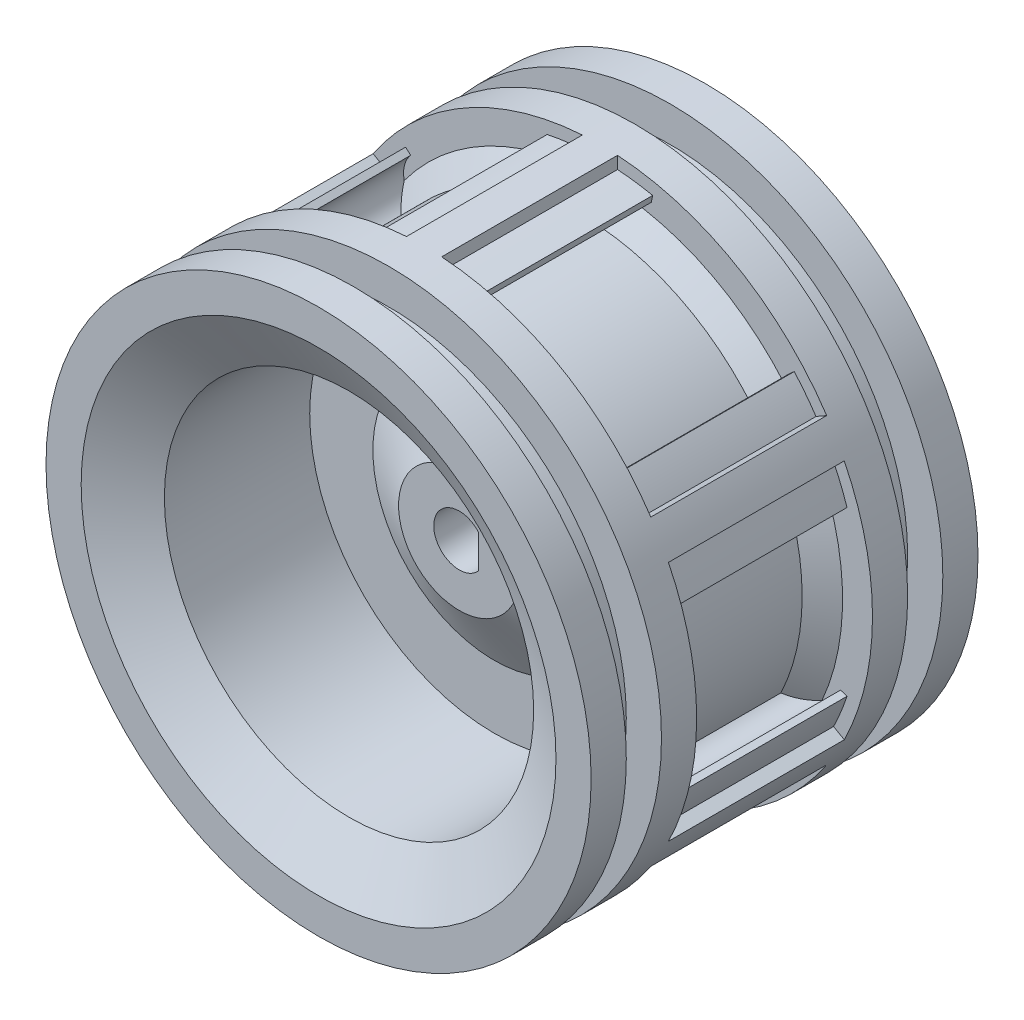
from build123d import *
from build123d.topology import SkipClean

# Parameters (mm, degrees)
EXTRUDE_1_DEPTH = 5
EXTRUDE_2_DEPTH = 16.5


with BuildPart() as part:
    # Эскиз2 → Повернуть1 (revolve)
    with BuildSketch(Plane(origin=(0, 0, 0), x_dir=(0, 0, -1), z_dir=(1, 0, 0)), mode=Mode.PRIVATE) as revolve_1_sk:
        with BuildLine():
            Line((4, 12.5), (-4, 12.5))
            Line((-4, 12.5), (-5, 13.799038106))
            Line((-5, 13.799038106), (-5, 15.5))
            Line((-5, 15.5), (-7, 15.5))
            Line((-7, 15.5), (-7, 13.5))
            Line((-7, 13.5), (-9, 13.5))
            Line((-9, 13.5), (-9, 15.5))
            Line((-9, 15.5), (-11, 15.5))
            Line((-11, 15.5), (-11, 13.5))
            Line((-11, 13.5), (-9.267949192, 10.5))
            Line((-9.267949192, 10.5), (-1.003318646, 10.5))
            Line((-1.003318646, 10.5), (-1.003318646, 6.908353552))
            Line((-1.003318646, 6.908353552), (-3, 3.45))
            Line((-3, 3.45), (-3, 1.45))
            Line((-3, 1.45), (10.5, 1.45))
            Line((10.5, 1.45), (13.5, 1.45))
            ThreePointArc((13.5, 1.45), (12.914213562, 2.864213562), (11.5, 3.45))
            ThreePointArc((11.5, 3.45), (10.792893219, 3.742893219), (10.5, 4.45))
            Line((10.5, 4.45), (10.5, 10.5))
            Line((10.5, 10.5), (11, 13.5))
            Line((11, 13.5), (11, 15.5))
            Line((11, 15.5), (9, 15.5))
            Line((9, 15.5), (9, 13.5))
            Line((9, 13.5), (7, 13.5))
            Line((7, 13.5), (7, 15.5))
            Line((7, 15.5), (5, 15.5))
            Line((5, 15.5), (5, 13.799038106))
            Line((5, 13.799038106), (4, 12.5))
        make_face()
    revolve(revolve_1_sk.sketch.rotate(Axis((0, 0, 12.144486905), (0, 0, -1)), 90), axis=Axis((0, 0, 12.144486905), (0, 0, -1)))

    # Эскиз4 → Бобышка-Вытянуть1 (add, symmetric)
    with SkipClean():  # the faces are left unmerged after this step: merging them gives an invalid solid
        with BuildSketch(Plane.XY):
            with BuildLine():
                Line((-1, 15.467708298), (-1, 14.766177569))
                ThreePointArc((-1, 14.766177569), (-2.004666987, 14.663604955), (-3, 14.492756812))
                Line((-3, 14.492756812), (-2.921430328, 14.113193095))
                ThreePointArc((-2.921430328, 14.113193095), (-1.553920806, 13.759344463), (-1, 12.459935794))
                ThreePointArc((-1, 12.459935794), (0, 12.5), (1, 12.459935794))
                ThreePointArc((1, 12.459935794), (1.553920806, 13.759344463), (2.921430328, 14.113193095))
                Line((2.921430328, 14.113193095), (3, 14.492756812))
                ThreePointArc((3, 14.492756812), (2.004666987, 14.663604955), (1, 14.766177569))
                Line((1, 14.766177569), (1, 15.467708298))
                ThreePointArc((1, 15.467708298), (0, 15.5), (-1, 15.467708298))
            make_face()
            with BuildLine():
                Line((12.895428325, 8.599879553), (12.287884892, 8.249114188))
                ThreePointArc((12.287884892, 8.249114188), (11.696720909, 9.067895014), (11.05109557, 9.844454617))
                Line((11.05109557, 9.844454617), (10.761668585, 9.586629427))
                ThreePointArc((10.761668585, 9.586629427), (11.138981441, 8.225407125), (10.290620927, 7.095993301))
                ThreePointArc((10.290620927, 7.095993301), (10.825317547, 6.25), (11.290620927, 5.363942493))
                ThreePointArc((11.290620927, 5.363942493), (12.692902247, 5.533937338), (13.683098913, 4.526563668))
                Line((13.683098913, 4.526563668), (14.05109557, 4.648302194))
                ThreePointArc((14.05109557, 4.648302194), (13.701387895, 5.595709941), (13.287884892, 6.517063381))
                Line((13.287884892, 6.517063381), (13.895428325, 6.867828745))
                ThreePointArc((13.895428325, 6.867828745), (13.423393759, 7.75), (12.895428325, 8.599879553))
            make_face()
            with BuildLine():
                Line((13.895428325, -6.867828745), (13.287884892, -6.517063381))
                ThreePointArc((13.287884892, -6.517063381), (13.701387895, -5.595709941), (14.05109557, -4.648302194))
                Line((14.05109557, -4.648302194), (13.683098913, -4.526563668))
                ThreePointArc((13.683098913, -4.526563668), (12.692902247, -5.533937338), (11.290620927, -5.363942493))
                ThreePointArc((11.290620927, -5.363942493), (10.825317547, -6.25), (10.290620927, -7.095993301))
                ThreePointArc((10.290620927, -7.095993301), (11.138981441, -8.225407125), (10.761668585, -9.586629427))
                Line((10.761668585, -9.586629427), (11.05109557, -9.844454617))
                ThreePointArc((11.05109557, -9.844454617), (11.696720909, -9.067895014), (12.287884892, -8.249114188))
                Line((12.287884892, -8.249114188), (12.895428325, -8.599879553))
                ThreePointArc((12.895428325, -8.599879553), (13.423393759, -7.75), (13.895428325, -6.867828745))
            make_face()
            with BuildLine():
                Line((1, -15.467708298), (1, -14.766177569))
                ThreePointArc((1, -14.766177569), (2.004666987, -14.663604955), (3, -14.492756812))
                Line((3, -14.492756812), (2.921430328, -14.113193095))
                ThreePointArc((2.921430328, -14.113193095), (1.553920806, -13.759344463), (1, -12.459935794))
                ThreePointArc((1, -12.459935794), (0, -12.5), (-1, -12.459935794))
                ThreePointArc((-1, -12.459935794), (-1.553920806, -13.759344463), (-2.921430328, -14.113193095))
                Line((-2.921430328, -14.113193095), (-3, -14.492756812))
                ThreePointArc((-3, -14.492756812), (-2.004666987, -14.663604955), (-1, -14.766177569))
                Line((-1, -14.766177569), (-1, -15.467708298))
                ThreePointArc((-1, -15.467708298), (0, -15.5), (1, -15.467708298))
            make_face()
            with BuildLine():
                Line((-12.895428325, -8.599879553), (-12.287884892, -8.249114188))
                ThreePointArc((-12.287884892, -8.249114188), (-11.696720909, -9.067895014), (-11.05109557, -9.844454617))
                Line((-11.05109557, -9.844454617), (-10.761668585, -9.586629427))
                ThreePointArc((-10.761668585, -9.586629427), (-11.138981441, -8.225407125), (-10.290620927, -7.095993301))
                ThreePointArc((-10.290620927, -7.095993301), (-10.825317547, -6.25), (-11.290620927, -5.363942493))
                ThreePointArc((-11.290620927, -5.363942493), (-12.692902247, -5.533937338), (-13.683098913, -4.526563668))
                Line((-13.683098913, -4.526563668), (-14.05109557, -4.648302194))
                ThreePointArc((-14.05109557, -4.648302194), (-13.701387895, -5.595709941), (-13.287884892, -6.517063381))
                Line((-13.287884892, -6.517063381), (-13.895428325, -6.867828745))
                ThreePointArc((-13.895428325, -6.867828745), (-13.423393759, -7.75), (-12.895428325, -8.599879553))
            make_face()
            with BuildLine():
                Line((-13.895428325, 6.867828745), (-13.287884892, 6.517063381))
                ThreePointArc((-13.287884892, 6.517063381), (-13.701387895, 5.595709941), (-14.05109557, 4.648302194))
                Line((-14.05109557, 4.648302194), (-13.683098913, 4.526563668))
                ThreePointArc((-13.683098913, 4.526563668), (-12.692902247, 5.533937338), (-11.290620927, 5.363942493))
                ThreePointArc((-11.290620927, 5.363942493), (-10.825317547, 6.25), (-10.290620927, 7.095993301))
                ThreePointArc((-10.290620927, 7.095993301), (-11.138981441, 8.225407125), (-10.761668585, 9.586629427))
                Line((-10.761668585, 9.586629427), (-11.05109557, 9.844454617))
                ThreePointArc((-11.05109557, 9.844454617), (-11.696720909, 9.067895014), (-12.287884892, 8.249114188))
                Line((-12.287884892, 8.249114188), (-12.895428325, 8.599879553))
                ThreePointArc((-12.895428325, 8.599879553), (-13.423393759, 7.75), (-13.895428325, 6.867828745))
            make_face()
        extrude(amount=EXTRUDE_1_DEPTH, both=True)

    # Эскиз5 → Бобышка-Вытянуть2 (add, through all)
    with SkipClean():  # the faces are left unmerged after this step: merging them gives an invalid solid
        with BuildSketch(Plane.XY.offset(3)):
            with BuildLine():
                Line((1.1, 0.944722181), (1.1, -0.944722181))
                ThreePointArc((1.1, -0.944722181), (1.45, 0), (1.1, 0.944722181))
            make_face()
        extrude(amount=-EXTRUDE_2_DEPTH)


solid = part.part
